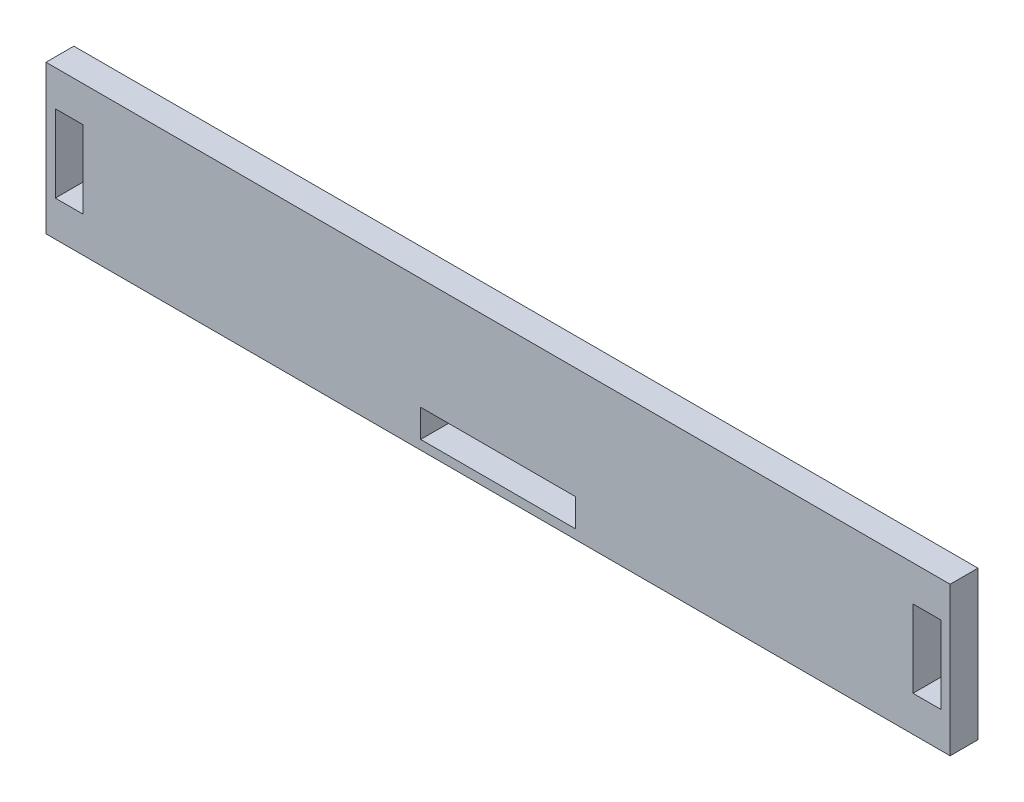
from build123d import *

# Parameters (mm, degrees)
SKETCH1_W           = 584
SKETCH1_H           = 96
SKETCH1_W_2         = 100
SKETCH1_H_2         = 18
SKETCH1_W_3         = 18
SKETCH1_H_3         = 50
BOSS_EXTRUDE6_DEPTH = 18


with BuildPart() as part:
    # Sketch1 → Boss-Extrude6 (new body)
    with BuildSketch(Plane.XY):
        with Locations((292, 48)):
            Rectangle(SKETCH1_W, SKETCH1_H)
        with Locations((292, 15)):
            Rectangle(SKETCH1_W_2, SKETCH1_H_2, mode=Mode.SUBTRACT)
        with Locations((569, 48)):
            Rectangle(SKETCH1_W_3, SKETCH1_H_3, mode=Mode.SUBTRACT)
        with Locations((15, 48)):
            Rectangle(SKETCH1_W_3, SKETCH1_H_3, mode=Mode.SUBTRACT)
    extrude(amount=BOSS_EXTRUDE6_DEPTH)


solid = part.part
